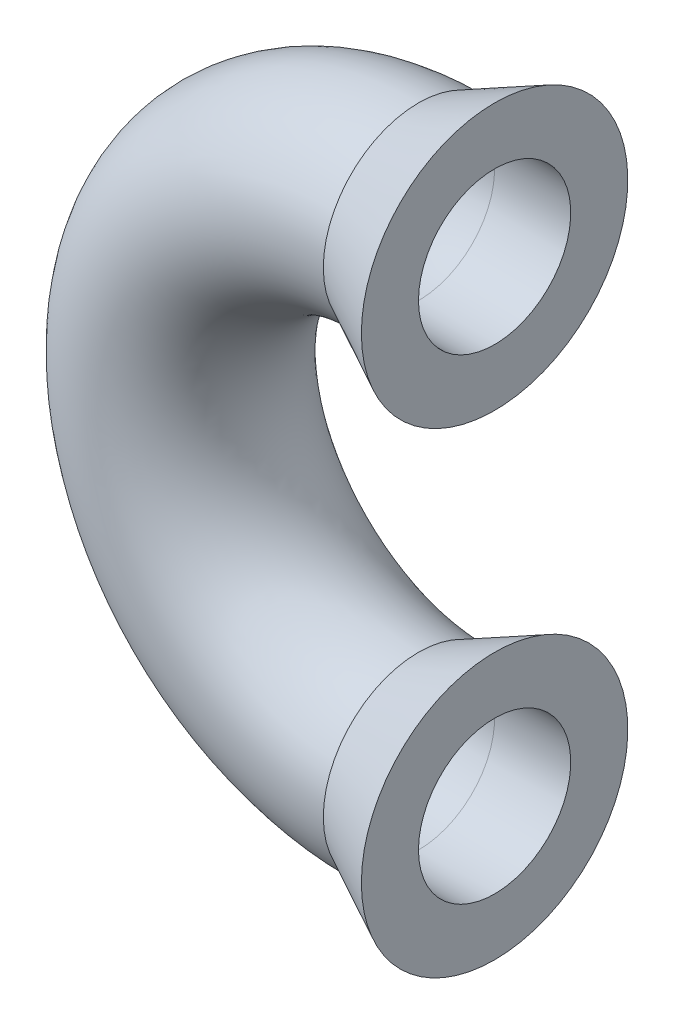
from build123d import *

# Parameters (mm, degrees)
SKETCH_2_R   = 5
SKETCH_2_R_2 = 4


with BuildPart() as part:
    # По траектории1: sweep along a path in Эскиз1
    with BuildLine(Plane.XY) as sweep_1_path:
        ThreePointArc((0, 12.5), (-12.5, 0), (0, -12.5))
    # Эскиз2 → По траектории1 (sweep)
    with BuildSketch(Plane(origin=(0, 0, 0), x_dir=(0, 0, -1), z_dir=(1, 0, 0))):
        with Locations((0, 12.5)):
            Circle(SKETCH_2_R)
        with Locations((0, 12.5)):
            Circle(SKETCH_2_R_2, mode=Mode.SUBTRACT)
    sweep(path=sweep_1_path.line)

    # Эскиз3 → Повернуть1 (revolve)
    with BuildSketch(Plane.XY, mode=Mode.PRIVATE) as revolve_1_sk:
        Polygon((4, 19.5), (0, 17.5), (0, 16.5), (4, 16.5), align=None)
    revolve(revolve_1_sk.sketch.rotate(Axis((-2.915316987, 12.5, 0), (1, 0, 0)), 270), axis=Axis((-2.915316987, 12.5, 0), (1, 0, 0)))

    # Эскиз5 → Повернуть2 (revolve)
    with BuildSketch(Plane.XY, mode=Mode.PRIVATE) as revolve_2_sk:
        Polygon((4, -5.5), (0, -7.5), (0, -8.5), (4, -8.5), align=None)
    revolve(revolve_2_sk.sketch.rotate(Axis((-1.97650581, -12.5, 0), (1, 0, 0)), 180), axis=Axis((-1.97650581, -12.5, 0), (1, 0, 0)))


solid = part.part
